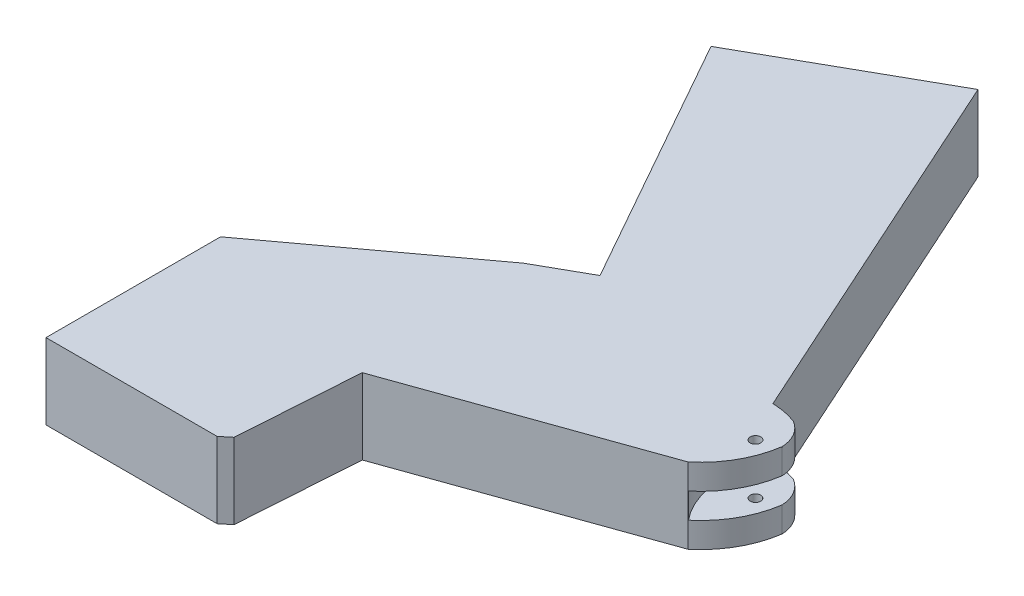
from build123d import *

# Parameters (mm, degrees)
BOSS_EXTRUDE1_DEPTH = 6
SKETCH3_W           = 6.408683363
SKETCH3_H           = 2
SKETCH4_R           = 0.418238454
CUT_EXTRUDE1_DEPTH  = 68.577687393
CUT_EXTRUDE2_DEPTH  = 7.07563293
CUT_EXTRUDE3_DEPTH  = 7.07563293
CUT_EXTRUDE4_DEPTH  = 8.636
SKETCH9_W           = 16.845523319
SKETCH9_H           = 13.536518873
CUT_EXTRUDE5_DEPTH  = 8.636
BOSS_EXTRUDE2_DEPTH = 6
CUT_EXTRUDE6_DEPTH  = 21.59
CUT_EXTRUDE7_DEPTH  = 20.574


with BuildPart() as part:
    # Sketch1 → Boss-Extrude1 (new body)
    with BuildSketch(Plane(origin=(0, 0, 0), x_dir=(1, 0, 0), z_dir=(0, 1, 0))):
        with BuildLine():
            Line((-30.417100683, -25.191255191), (-60.834201366, -25.191255191))
            Line((-60.834201366, -25.191255191), (-60.834201366, -11.654736318))
            Line((-60.834201366, -11.654736318), (-42.452724359, -11.654736318))
            Line((-42.452724359, -11.654736318), (-55.326541771, 11.21298086))
            Line((-55.326541771, 11.21298086), (-24.071247352, 28.808744809))
            Line((-24.071247352, 28.808744809), (-8.250197814, 1.40588318))
            ThreePointArc((-8.250197814, 1.40588318), (-7.349372036, -3.751451104), (-9.988929311, -8.27276965))
            Line((-9.988929311, -8.27276965), (-30.417100683, -25.191255191))
        make_face()
    extrude(amount=BOSS_EXTRUDE1_DEPTH)

    # Sketch3 → Cut-Revolve1 (revolve, cut)
    with BuildSketch(Plane(origin=(0, 0, 0), x_dir=(0.7701644134023178, 0, -0.6378454172671179), z_dir=(0.6378454172671179, 0, 0.7701644134023178))):
        with Locations((-9.738380512, 3)):
            Rectangle(SKETCH3_W, SKETCH3_H)
    revolve(axis=Axis((-5.032284182, 4, 4.167706724), (0, -1, 0)), mode=Mode.SUBTRACT)

    # Sketch4 → Cut-Extrude1 (cut, through all)
    with BuildSketch(Plane(origin=(0, 6, 0), x_dir=(1, 0, 0), z_dir=(0, 1, 0))):
        with Locations(Location((-8.825601509, -4.086499086, 0), (0, 0, 270))):
            Circle(SKETCH4_R)
    extrude(amount=-CUT_EXTRUDE1_DEPTH, mode=Mode.SUBTRACT)

    # Sketch5 → Cut-Extrude2 (cut)
    with BuildSketch(Plane.XZ):
        with BuildLine():
            Line((-24.071247352, -28.808744809), (-10.627789176, 0.89898626))
            ThreePointArc((-10.627789176, 0.89898626), (-8.855926732, 1.209162301), (-7.240059857, 1.999529264))
            ThreePointArc((-7.240059857, 1.999529264), (-7.543928563, 0.237141569), (-8.250197814, -1.40588318))
            Line((-8.250197814, -1.40588318), (-24.071247352, -28.808744809))
        make_face()
    extrude(amount=-CUT_EXTRUDE2_DEPTH, mode=Mode.SUBTRACT)

    # Sketch6 → Cut-Extrude3 (cut)
    with BuildSketch(Plane(origin=(0, 0, 0), x_dir=(-1, 0, 0), z_dir=(0, -1, 0))):
        with BuildLine():
            Line((8.621369431, -1.290415749), (6.275781013, -0.723765639))
            Line((6.275781013, -0.723765639), (7.306606233, -3.4867058))
            ThreePointArc((7.306606233, -3.4867058), (7.684746322, -2.221398672), (8.621369431, -1.290415749))
        make_face()
    extrude(amount=-CUT_EXTRUDE3_DEPTH, mode=Mode.SUBTRACT)

    # Sketch7 → Cut-Extrude4 (cut)
    with BuildSketch(Plane(origin=(0, 6, 0), x_dir=(1, 0, 0), z_dir=(0, 1, 0))):
        Polygon((-9.988929311, -8.27276965), (-29.038929311, -15.05806632), (-29.682744971, -24.58306632), align=None)
    extrude(amount=-CUT_EXTRUDE4_DEPTH, mode=Mode.SUBTRACT)

    # Sketch9 → Cut-Extrude5 (cut)
    with BuildSketch(Plane(origin=(0, 6, 0), x_dir=(1, 0, 0), z_dir=(0, 1, 0))):
        with Locations((-52.411439707, -18.422995755)):
            Rectangle(SKETCH9_W, SKETCH9_H)
    extrude(amount=-CUT_EXTRUDE5_DEPTH, mode=Mode.SUBTRACT)

    # Sketch10 → Boss-Extrude2 (add)
    with BuildSketch(Plane.XZ):
        Polygon((-43.988678047, 11.654736318), (-43.988678047, 8.926427114), (-42.452724359, 11.654736318), align=None)
    extrude(amount=-BOSS_EXTRUDE2_DEPTH)

    # Sketch11 → Cut-Extrude6 (cut)
    with BuildSketch(Plane.XZ):
        Polygon((-55.326541771, -11.21298086), (-43.988678047, 8.926427114), (-26.281813284, -1.041990026), (-37.619677009, -21.181398001), align=None)
    extrude(amount=-CUT_EXTRUDE6_DEPTH, mode=Mode.SUBTRACT)

    # Sketch12 → Cut-Extrude7 (cut)
    with BuildSketch(Plane(origin=(0, 6, 0), x_dir=(1, 0, 0), z_dir=(0, 1, 0))):
        Polygon((-43.988678047, -11.348752844), (-30.168184759, -1.145916898), (-43.988678047, -8.926427114), align=None)
    extrude(amount=-CUT_EXTRUDE7_DEPTH, mode=Mode.SUBTRACT)


solid = part.part
